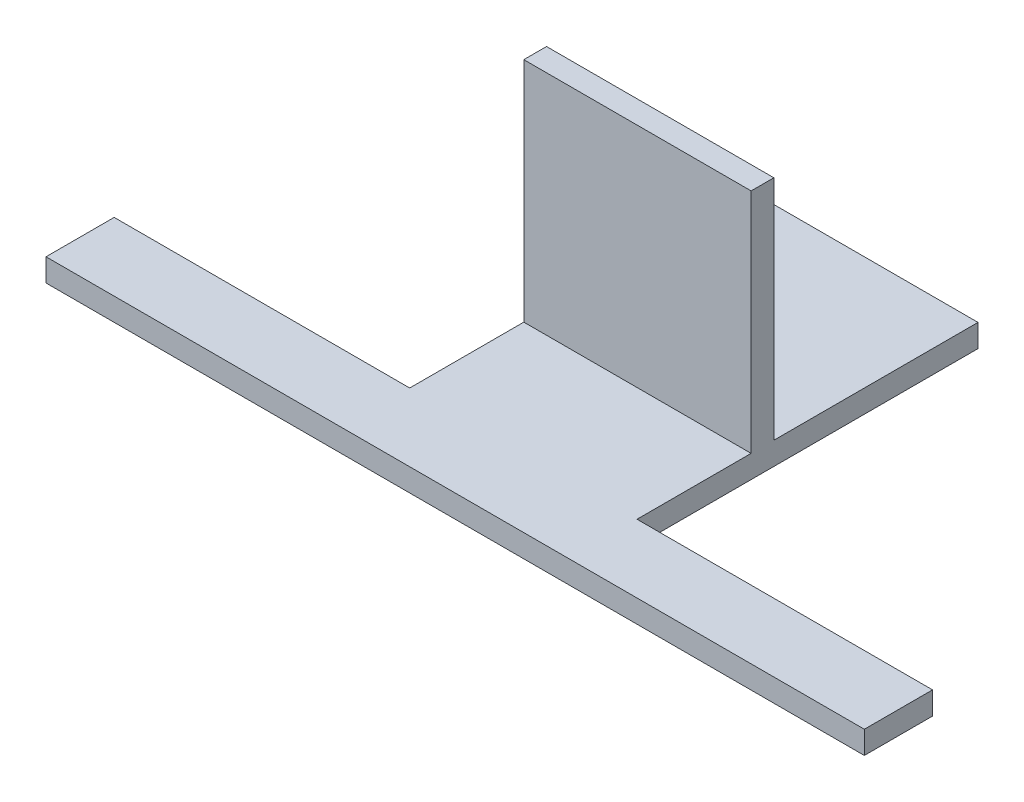
from build123d import *

# Parameters (mm, degrees)
SKETCH_1_W      = 360
SKETCH_1_H      = 30
EXTRUDE_1_DEPTH = 10
SKETCH_2_W      = 100
SKETCH_2_H      = 10
EXTRUDE_2_DEPTH = 150
SKETCH_3_W      = 100
SKETCH_3_H      = 10
EXTRUDE_3_DEPTH = 100


with BuildPart() as part:
    # Эскиз1 → Бобышка-Вытянуть1 (new body)
    with BuildSketch(Plane(origin=(0, 0, 0), x_dir=(1, 0, 0), z_dir=(0, 1, 0))):
        with Locations((180, 15)):
            Rectangle(SKETCH_1_W, SKETCH_1_H)
    extrude(amount=EXTRUDE_1_DEPTH)

    # Эскиз2 → Бобышка-Вытянуть2 (add)
    with BuildSketch(Plane(origin=(0, 0, -30), x_dir=(-1, 0, 0), z_dir=(0, 0, -1))):
        with Locations((-180, 5)):
            Rectangle(SKETCH_2_W, SKETCH_2_H)
    extrude(amount=EXTRUDE_2_DEPTH)

    # Эскиз3 → Бобышка-Вытянуть3 (add)
    with BuildSketch(Plane(origin=(0, 10, 0), x_dir=(1, 0, 0), z_dir=(0, 1, 0))):
        with Locations((180, 85.192796995)):
            Rectangle(SKETCH_3_W, SKETCH_3_H)
    extrude(amount=EXTRUDE_3_DEPTH)


solid = part.part
